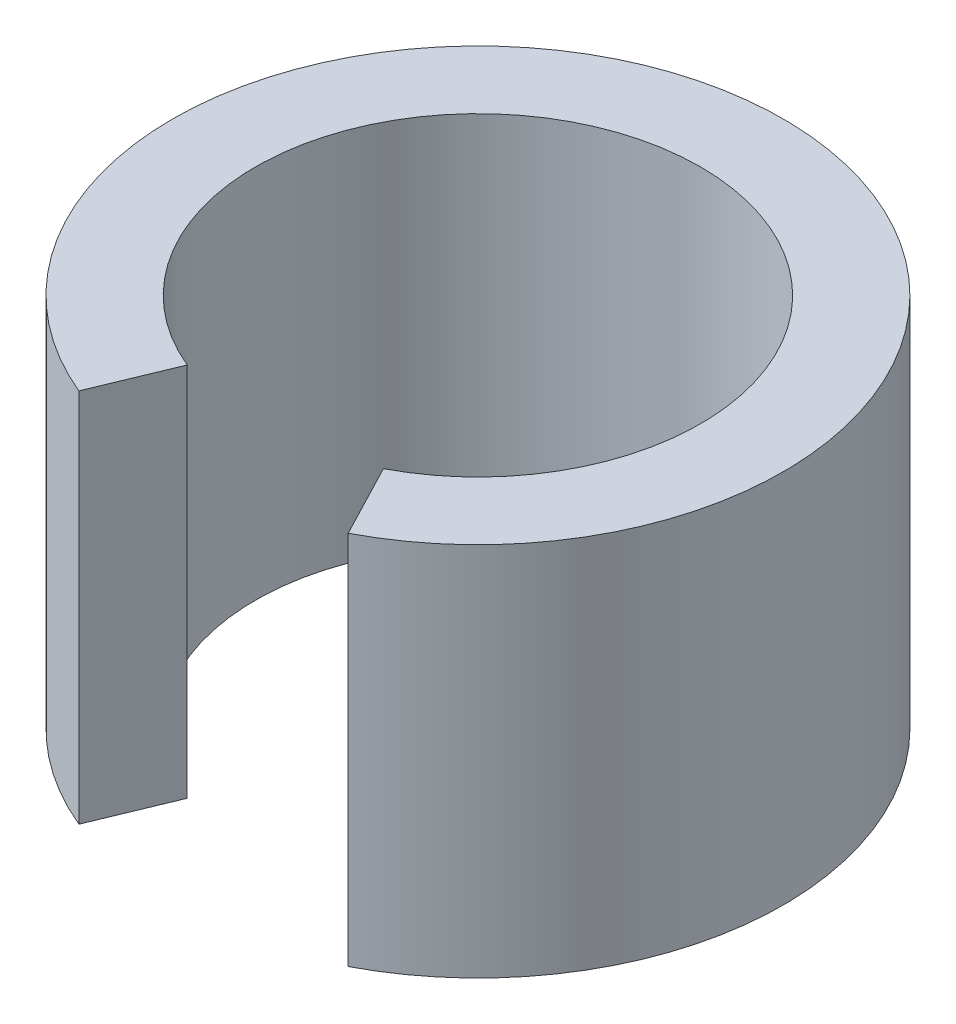
from build123d import *

# Parameters (mm, degrees)
BOSS_EXTRUDE1_DEPTH = 4.3


with BuildPart() as part:
    # Sketch1 → Boss-Extrude1 (new body)
    with BuildSketch(Plane(origin=(0, 0, 0), x_dir=(1, 0, 0), z_dir=(0, 1, 0))):
        with BuildLine():
            Line((-1.338169847, -3.234084331), (-0.974952317, -2.356261441))
            ThreePointArc((-0.974952317, -2.356261441), (-0.112192238, 2.547530746), (1.178313714, -2.261432464))
            Line((1.178313714, -2.261432464), (1.617293333, -3.103926912))
            ThreePointArc((1.617293333, -3.103926912), (-0.153989346, 3.496610828), (-1.338169847, -3.234084331))
        make_face()
    extrude(amount=BOSS_EXTRUDE1_DEPTH)


solid = part.part
